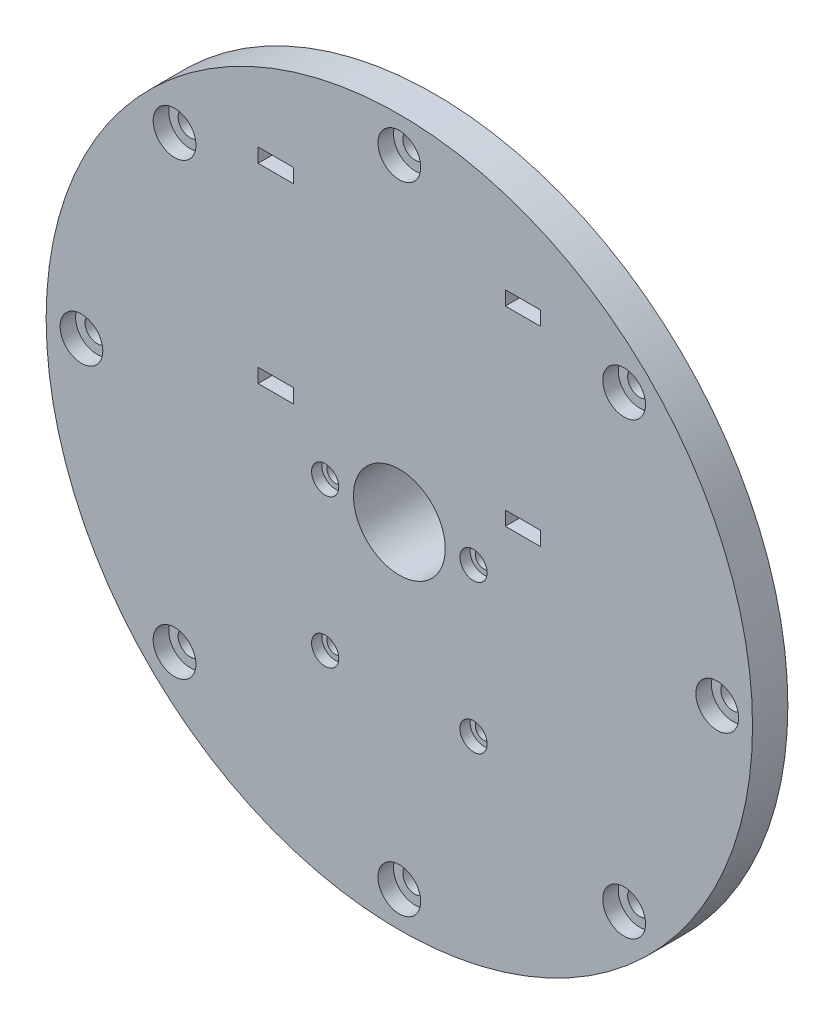
from build123d import *

# Parameters (mm, degrees)
SKETCH_1_R                   = 50
EXTRUDE_1_DEPTH              = 5
SKETCH_8_W                   = 26
SKETCH_8_H                   = 32.5
EXTRUDE_3_DEPTH              = 10
SKETCH_6_R                   = 6.5
CUT_EXTRUDE_1_DEPTH          = 73.284161474
HOLE_WIZARD_M2_1_D           = 2.4
HOLE_WIZARD_M2_1_CBORE_D     = 3.85
HOLE_WIZARD_M2_1_CBORE_DEPTH = 1.45
HOLE_WIZARD_M3_2_D           = 3.4
HOLE_WIZARD_M3_2_CBORE_D     = 6.05
HOLE_WIZARD_M3_2_CBORE_DEPTH = 2.2
PATTERN_CIRCULAR_1_COUNT     = 8
SKETCH_7_W                   = 3
SKETCH_7_H                   = 15
EXTRUDE_2_DEPTH              = 3
FILLET_1_R                   = 1
FILLET_1_OF_MIRROR_2_R       = 1
FILLET_2_R                   = 2.5
SKETCH_9_W                   = 5
SKETCH_9_H                   = 2
CUT_EXTRUDE_2_DEPTH          = 72.414284285


with BuildPart() as part:
    # ｽｹｯﾁ1 → ﾎﾞｽ - 押し出し1 (new body)
    with BuildSketch(Plane.XY):
        Circle(SKETCH_1_R)
    extrude(amount=EXTRUDE_1_DEPTH)

    # ｽｹｯﾁ8 → ﾎﾞｽ - 押し出し3 (add)
    with BuildSketch(Plane(origin=(0, 0, 0), x_dir=(-1, 0, 0), z_dir=(0, 0, -1))):
        with Locations((0, -7.37)):
            Rectangle(SKETCH_8_W, SKETCH_8_H)
    extrude(amount=EXTRUDE_3_DEPTH)

    # ｽｹｯﾁ6 → ｶｯﾄ - 押し出し1 (cut, through all)
    with BuildSketch(Plane.XY.offset(5)):
        Circle(SKETCH_6_R)
    extrude(amount=-CUT_EXTRUDE_1_DEPTH, mode=Mode.SUBTRACT)

    # M2 丸平ねじ用座ぐり穴1 (through all)
    with Locations(Plane.XY.offset(5)):
        with Locations((-10.5, 0), (-10.5, -21)):
            hole_wizard_m2_1 = CounterBoreHole(HOLE_WIZARD_M2_1_D / 2, HOLE_WIZARD_M2_1_CBORE_D / 2, HOLE_WIZARD_M2_1_CBORE_DEPTH)

    # ﾐﾗｰ1: M2 丸平ねじ用座ぐり穴1 across plane
    add(hole_wizard_m2_1.mirror(Plane(origin=(0, 0, 0), x_dir=(0, 0, 1), z_dir=(1, 0, 0))), mode=Mode.SUBTRACT)

    # M3 丸平ねじ用座ぐり穴2 (through all)
    with Locations(Plane.XY.offset(5)):
        with Locations((45, 0)):
            hole_wizard_m3_2 = CounterBoreHole(HOLE_WIZARD_M3_2_D / 2, HOLE_WIZARD_M3_2_CBORE_D / 2, HOLE_WIZARD_M3_2_CBORE_DEPTH)

    # 円形ﾊﾟﾀｰﾝ1: M3 丸平ねじ用座ぐり穴2 ×8 about axis
    pattern_circular_1_axis = Axis((0, 0, 0), (0, 0, 1))
    for i in range(1, PATTERN_CIRCULAR_1_COUNT):
        add(hole_wizard_m3_2.rotate(pattern_circular_1_axis, i * 360 / PATTERN_CIRCULAR_1_COUNT), mode=Mode.SUBTRACT)

    # ｽｹｯﾁ7 → ﾎﾞｽ - 押し出し2 (add)
    with BuildSketch(Plane(origin=(0, 0, 0), x_dir=(-1, 0, 0), z_dir=(0, 0, -1))):
        with Locations((26.5, 17.5)):
            Rectangle(SKETCH_7_W, SKETCH_7_H)
    extrude_2 = extrude(amount=EXTRUDE_2_DEPTH)

    # ﾌｨﾚｯﾄ1
    fillet_1_edges = [part.edges().sort_by_distance(p)[0] for p in [
        (-28, 17.5, 0),
    ]]
    fillet(fillet_1_edges, radius=FILLET_1_R)

    # ﾐﾗｰ2: ﾎﾞｽ - 押し出し2 across plane
    add(extrude_2.mirror(Plane(origin=(0, 0, 0), x_dir=(0, 0, 1), z_dir=(1, 0, 0))))

    # ﾌｨﾚｯﾄ1 of ﾐﾗｰ2
    fillet_1_of_mirror_2_edges = [part.edges().sort_by_distance(p)[0] for p in [
        (28, 17.5, 0),
    ]]
    fillet(fillet_1_of_mirror_2_edges, radius=FILLET_1_OF_MIRROR_2_R)

    # ﾌｨﾚｯﾄ2
    fillet_2_edges = [part.edges().sort_by_distance(p)[0] for p in [
        (-13, -23.62, -5),
        (-13, 8.88, -5),
        (13, 8.88, -5),
        (13, -23.62, -5),
    ]]
    fillet(fillet_2_edges, radius=FILLET_2_R)

    # ｽｹｯﾁ9 → ｶｯﾄ - 押し出し2 (cut, through all)
    with BuildSketch(Plane(origin=(0, 0, 0), x_dir=(-1, 0, 0), z_dir=(0, 0, -1))):
        with Locations((17.5, 35)):
            Rectangle(SKETCH_9_W, SKETCH_9_H)
        with Locations((17.5, 8)):
            Rectangle(SKETCH_9_W, SKETCH_9_H)
    cut_extrude_2 = extrude(amount=-CUT_EXTRUDE_2_DEPTH, mode=Mode.SUBTRACT)

    # ﾐﾗｰ3: ｶｯﾄ - 押し出し2 across plane
    add(cut_extrude_2.mirror(Plane(origin=(0, 0, 0), x_dir=(0, 0, 1), z_dir=(1, 0, 0))), mode=Mode.SUBTRACT)


solid = part.part
